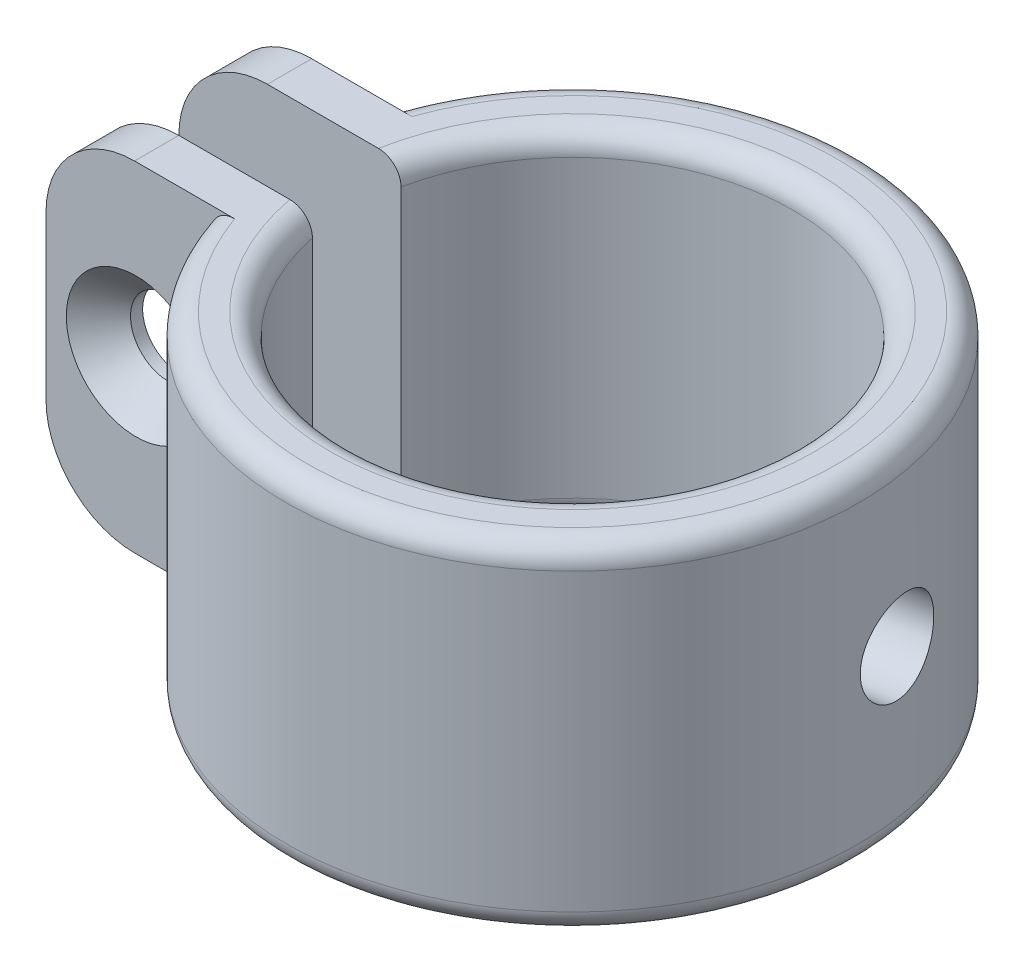
from build123d import *

# Parameters (mm, degrees)
SKETCH1_W                                       = 3
SKETCH1_H                                       = 15.333447248
FILLET1_R                                       = 1
SKETCH3_W                                       = 5.264666588
SKETCH3_H                                       = 15.659008314
CUT_EXTRUDE1_DEPTH                              = 2
BOSS_EXTRUDE1_START                             = -2
BOSS_EXTRUDE1_DEPTH                             = 2
CSK_FOR_M3_FLAT_HEAD_MACHINE_SCREW1_D           = 3.4
CSK_FOR_M3_FLAT_HEAD_MACHINE_SCREW1_DEPTH       = 10.05
CSK_FOR_M3_FLAT_HEAD_MACHINE_SCREW1_CSINK_D     = 6.3
CSK_FOR_M3_FLAT_HEAD_MACHINE_SCREW1_CSINK_ANGLE = 90
CSK_FOR_M3_FLAT_HEAD_MACHINE_SCREW1_TIP         = 1.021463052
CUT_EXTRUDE2_DEPTH                              = 1
F_4_0MM_DOWEL_HOLE1_D                           = 4
F_4_0MM_DOWEL_HOLE1_DEPTH                       = 10.05
F_4_0MM_DOWEL_HOLE1_TIP                         = 1.201721238


with BuildPart() as part:
    # Sketch1 → Revolve1 (revolve)
    with BuildSketch(Plane.XY, mode=Mode.PRIVATE) as revolve1_sk:
        with Locations((11.45, 44.609155007)):
            Rectangle(SKETCH1_W, SKETCH1_H)
    revolve(revolve1_sk.sketch.rotate(Axis((0, 0, 0), (0, 1, 0)), 90), axis=Axis((0, 0, 0), (0, 1, 0)))

    # Fillet1
    fillet1_edges = [part.edges().sort_by_distance(p)[0] for p in [
        (0, 36.942431383, 12.95),
        (0, 36.942431383, 9.95),
        (0, 52.275878631, 9.95),
        (0, 52.275878631, 12.95),
    ]]
    fillet(fillet1_edges, radius=FILLET1_R)

    # Sketch3 → Cut-Extrude1 (cut, symmetric)
    with BuildSketch(Plane.XY):
        with Locations((-11.811751961, 44.609155007)):
            Rectangle(SKETCH3_W, SKETCH3_H)
    extrude(amount=CUT_EXTRUDE1_DEPTH, both=True, mode=Mode.SUBTRACT)

    # Sketch4 → Boss-Extrude1 (add)
    with BuildSketch(Plane.XY.offset(BOSS_EXTRUDE1_START)):
        with BuildLine():
            Line((-10.765802339, 36.942431383), (-11.78144728, 36.942431383))
            Line((-11.78144728, 36.942431383), (-15.78144728, 36.942431383))
            ThreePointArc((-15.78144728, 36.942431383), (-18.609874404, 38.114004258), (-19.78144728, 40.942431383))
            Line((-19.78144728, 40.942431383), (-19.78144728, 48.275878631))
            ThreePointArc((-19.78144728, 48.275878631), (-18.609874404, 51.104305755), (-15.78144728, 52.275878631))
            Line((-15.78144728, 52.275878631), (-11.78144728, 52.275878631))
            Line((-11.78144728, 52.275878631), (-10.765802339, 52.275878631))
            add(Edge.make_bspline(
                [(-10.765802339, 52.275878631), (-10.500112366, 52.275878631), (-10.238450482, 52.170503321), (-9.953693712, 51.89343795), (-9.877457221, 51.782535359), (-9.774105823, 51.54007732), (-9.746922591, 51.407382002), (-9.746922591, 51.275878631)],
                knots=[0, 0, 0, 0, 0.5, 0.5, 0.75, 0.75, 1, 1, 1, 1], degree=3))
            Line((-9.746922591, 51.275878631), (-9.746922591, 37.942431383))
            add(Edge.make_bspline(
                [(-9.746922591, 37.942431383), (-9.746922591, 37.809588715), (-9.774100223, 37.678218647), (-9.877525583, 37.43564148), (-9.954242105, 37.324386008), (-10.142607782, 37.14101321), (-10.256018848, 37.067252248), (-10.499784937, 36.968574056), (-10.633510954, 36.942431383), (-10.765802339, 36.942431383)],
                knots=[0, 0, 0, 0, 0.25, 0.25, 0.5, 0.5, 0.75, 0.75, 1, 1, 1, 1], degree=3))
        make_face()
    boss_extrude1 = extrude(amount=-BOSS_EXTRUDE1_DEPTH)

    # Mirror1: Boss-Extrude1 across plane
    add(boss_extrude1.mirror(Plane.XY))

    # CSK for M3 Flat Head Machine Screw1
    with Locations(Plane.XY.offset(4)):
        with Locations((-15.715293292, 44.666817053)):
            CounterSinkHole(CSK_FOR_M3_FLAT_HEAD_MACHINE_SCREW1_D / 2, CSK_FOR_M3_FLAT_HEAD_MACHINE_SCREW1_CSINK_D / 2, depth=CSK_FOR_M3_FLAT_HEAD_MACHINE_SCREW1_DEPTH, counter_sink_angle=CSK_FOR_M3_FLAT_HEAD_MACHINE_SCREW1_CSINK_ANGLE)
            with Locations((0, 0, -(CSK_FOR_M3_FLAT_HEAD_MACHINE_SCREW1_DEPTH + CSK_FOR_M3_FLAT_HEAD_MACHINE_SCREW1_TIP / 2))):  # 118° drill point
                Cone(0, CSK_FOR_M3_FLAT_HEAD_MACHINE_SCREW1_D / 2, CSK_FOR_M3_FLAT_HEAD_MACHINE_SCREW1_TIP, mode=Mode.SUBTRACT)

    # Sketch7 → Cut-Extrude2 (cut)
    with BuildSketch(Plane(origin=(0, 0, -4), x_dir=(-1, 0, 0), z_dir=(0, 0, -1))):
        Polygon((15.715293292, 47.89997856), (12.915293292, 46.283397807), (12.915293292, 43.050236299), (15.715293292, 41.433655546), (18.515293292, 43.050236299), (18.515293292, 46.283397807), align=None)
    extrude(amount=-CUT_EXTRUDE2_DEPTH, mode=Mode.SUBTRACT)

    # Ø4.0mm Dowel Hole1
    with Locations(Plane(origin=(12.787403049, 44.540807009, -2.04568406), x_dir=(0.157967881081, 0, 0.987444250855), z_dir=(0.987444250855, 0, -0.157967881081))):
        with Locations((0, 0)):
            Hole(F_4_0MM_DOWEL_HOLE1_D / 2, depth=F_4_0MM_DOWEL_HOLE1_DEPTH)
            with Locations((0, 0, -(F_4_0MM_DOWEL_HOLE1_DEPTH + F_4_0MM_DOWEL_HOLE1_TIP / 2))):  # 118° drill point
                Cone(0, F_4_0MM_DOWEL_HOLE1_D / 2, F_4_0MM_DOWEL_HOLE1_TIP, mode=Mode.SUBTRACT)


solid = part.part
